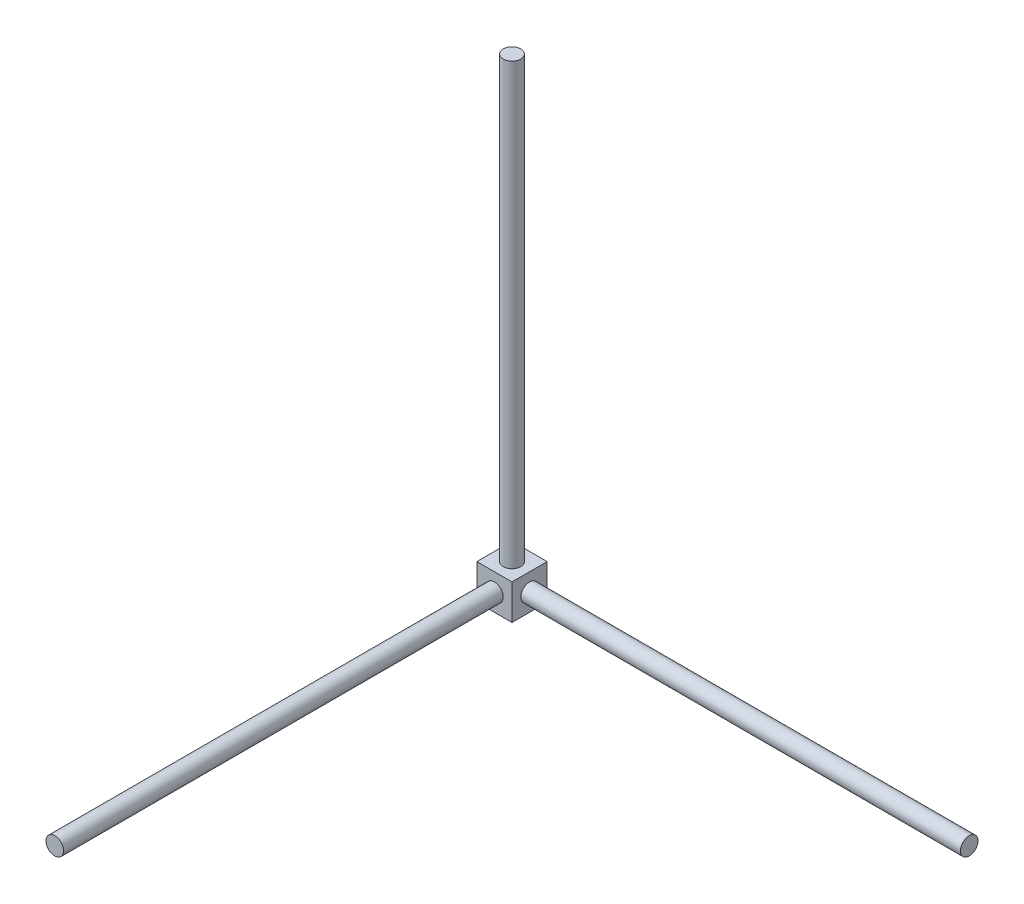
from build123d import *

# Parameters (mm, degrees)
SKETCH1_W           = 20
SKETCH1_H           = 20
BOSS_EXTRUDE1_DEPTH = 10
SKETCH2_R           = 5
BOSS_EXTRUDE2_DEPTH = 250
SKETCH3_R           = 5
BOSS_EXTRUDE3_DEPTH = 250
SKETCH4_R           = 5
BOSS_EXTRUDE4_DEPTH = 250


with BuildPart() as part:
    # Sketch1 → Boss-Extrude1 (new, symmetric)
    with BuildSketch(Plane(origin=(0, 0, 0), x_dir=(1, 0, 0), z_dir=(0, 1, 0))):
        Rectangle(SKETCH1_W, SKETCH1_H)
    extrude(amount=BOSS_EXTRUDE1_DEPTH, both=True)

    # Sketch2 → Boss-Extrude2 (add)
    with BuildSketch(Plane(origin=(10, 0, 0), x_dir=(0, 0, -1), z_dir=(1, 0, 0))):
        Circle(SKETCH2_R)
    extrude(amount=BOSS_EXTRUDE2_DEPTH)

    # Sketch3 → Boss-Extrude3 (add)
    with BuildSketch(Plane.XY.offset(10)):
        Circle(SKETCH3_R)
    extrude(amount=BOSS_EXTRUDE3_DEPTH)

    # Sketch4 → Boss-Extrude4 (add)
    with BuildSketch(Plane(origin=(0, 10, 0), x_dir=(1, 0, 0), z_dir=(0, 1, 0))):
        with Locations(Location((0, 0, 0), (0, 0, 270))):
            Circle(SKETCH4_R)
    extrude(amount=BOSS_EXTRUDE4_DEPTH)


solid = part.part
